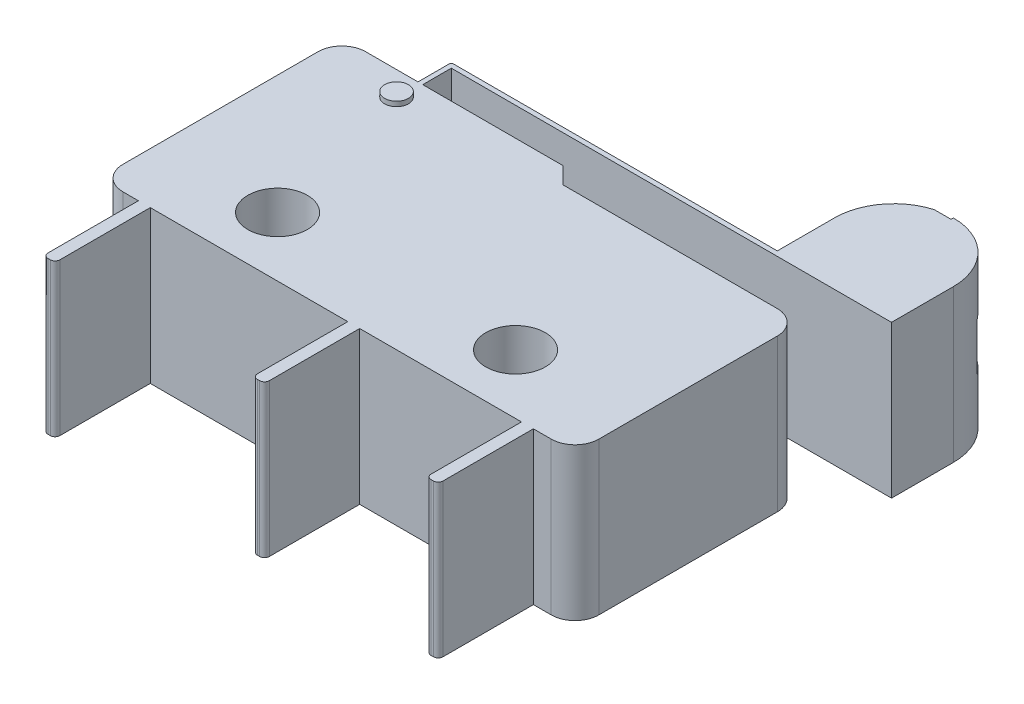
from build123d import *

# Parameters (mm, degrees)
BOSS_EXTRUDE1_DEPTH     = 6.4
FILLET1_R               = 1
SKETCH2_R               = 0.5
BOSS_EXTRUDE2_DEPTH     = 0.2
SKETCH3_W               = 18.5
SKETCH3_H               = 0.1
SKETCH3_W_2             = 0.1
SKETCH3_H_2             = 1.2
BOSS_EXTRUDE3_DEPTH     = 6.4
BOSS_EXTRUDE4_DEPTH     = 6.4
SKETCH5_R               = 1.25
CUT_EXTRUDE1_DEPTH      = 29.157059506
SKETCH6_W               = 0.5
SKETCH6_H               = 4
BOSS_EXTRUDE5_DEPTH     = 6.4
FILLET2_R               = 0.2
CUT_EXTRUDE2_DEPTH      = 10
CUT_EXTRUDE3_DEPTH      = 25.523865927
CUT_EXTRUDE3_DEPTH_BACK = 25.523865927
SKETCH9_W               = 1
SKETCH9_H               = 1


with BuildPart() as part:
    # Sketch1 → Boss-Extrude1 (new body)
    with BuildSketch(Plane(origin=(0, 0, 0), x_dir=(1, 0, 0), z_dir=(0, 1, 0))):
        Polygon((0, 0), (20, 0), (20, 9.5), (10, 9.5), (9.3, 10.2), (0, 10.2), align=None)
    extrude(amount=BOSS_EXTRUDE1_DEPTH)

    # Fillet1
    fillet1_edges = [part.edges().sort_by_distance(p)[0] for p in [
        (0, 3.2, -10.2),
        (20, 3.2, -9.5),
        (20, 3.2, 0),
        (0, 3.2, 0),
    ]]
    fillet(fillet1_edges, radius=FILLET1_R)

    # Sketch2 → Boss-Extrude2 (add)
    with BuildSketch(Plane(origin=(0, 6.4, 0), x_dir=(1, 0, 0), z_dir=(0, 1, 0))):
        with Locations(Location((3.3, 9.2, 0), (0, 0, 90))):
            Circle(SKETCH2_R)
    extrude(amount=BOSS_EXTRUDE2_DEPTH)

    # Sketch3 → Boss-Extrude3 (add)
    with BuildSketch(Plane(origin=(0, 6.4, 0), x_dir=(1, 0, 0), z_dir=(0, 1, 0))):
        with BuildLine():
            ThreePointArc((3.3, 11.6), (3.370710678, 11.570710678), (3.4, 11.5))
            Line((3.4, 11.5), (21.9, 11.5))
            Line((21.9, 11.5), (21.9, 11.6))
            Line((21.9, 11.6), (3.3, 11.6))
        make_face()
        with Locations((12.65, 11.45)):
            Rectangle(SKETCH3_W, SKETCH3_H)
        with BuildLine():
            ThreePointArc((3.4, 11.5), (3.370710678, 11.429289322), (3.3, 11.4))
            Line((3.3, 11.4), (3.4, 11.4))
            Line((3.4, 11.4), (3.4, 11.5))
        make_face()
        with BuildLine():
            ThreePointArc((3.2, 11.5), (3.229289322, 11.429289322), (3.3, 11.4))
            Line((3.3, 11.4), (3.3, 11.5))
            Line((3.3, 11.5), (3.4, 11.5))
            ThreePointArc((3.4, 11.5), (3.370710678, 11.570710678), (3.3, 11.6))
            ThreePointArc((3.3, 11.6), (3.229289322, 11.570710678), (3.2, 11.5))
        make_face()
        with BuildLine():
            Line((3.3, 11.5), (3.3, 11.4))
            ThreePointArc((3.3, 11.4), (3.370710678, 11.429289322), (3.4, 11.5))
            Line((3.4, 11.5), (3.3, 11.5))
        make_face()
        with Locations((3.35, 10.8)):
            Rectangle(SKETCH3_W_2, SKETCH3_H_2)
        with BuildLine():
            Line((3.3, 10.2), (3.3, 11.4))
            ThreePointArc((3.3, 11.4), (3.229289322, 11.429289322), (3.2, 11.5))
            Line((3.2, 11.5), (3.2, 10.2))
            Line((3.2, 10.2), (3.3, 10.2))
        make_face()
    extrude(amount=-BOSS_EXTRUDE3_DEPTH)

    # Sketch4 → Boss-Extrude4 (add)
    with BuildSketch(Plane(origin=(0, 6.4, 0), x_dir=(1, 0, 0), z_dir=(0, 1, 0))):
        with BuildLine():
            Line((20.1, 11.6), (21.9, 11.6))
            Line((21.9, 11.6), (21.9, 14))
            ThreePointArc((21.9, 14), (21.4, 12.5), (20.1, 11.6))
        make_face()
        with BuildLine():
            ThreePointArc((18.7, 11.6), (19.046446609, 11.525126266), (19.4, 11.5))
            Line((19.4, 11.5), (19.4, 11.6))
            Line((19.4, 11.6), (18.7, 11.6))
        make_face()
        with BuildLine():
            Line((19.4, 11.6), (19.4, 11.5))
            ThreePointArc((19.4, 11.5), (19.753553391, 11.525126266), (20.1, 11.6))
            Line((20.1, 11.6), (19.4, 11.6))
        make_face()
        with BuildLine():
            Line((18.7, 11.6), (19.4, 11.6))
            Line((19.4, 11.6), (19.4, 16.5))
            ThreePointArc((19.4, 16.5), (17.632233047, 15.767766953), (16.9, 14))
            ThreePointArc((16.9, 14), (17.4, 12.5), (18.7, 11.6))
        make_face()
        with BuildLine():
            Line((19.4, 16.5), (19.4, 11.6))
            Line((19.4, 11.6), (20.1, 11.6))
            ThreePointArc((20.1, 11.6), (21.4, 12.5), (21.9, 14))
            ThreePointArc((21.9, 14), (21.167766953, 15.767766953), (19.4, 16.5))
        make_face()
        with BuildLine():
            Line((16.9, 11.6), (18.7, 11.6))
            ThreePointArc((18.7, 11.6), (17.4, 12.5), (16.9, 14))
            Line((16.9, 14), (16.9, 11.6))
        make_face()
    extrude(amount=-BOSS_EXTRUDE4_DEPTH)

    # Sketch5 → Cut-Extrude1 (cut, through all)
    with BuildSketch(Plane(origin=(0, 6.4, 0), x_dir=(1, 0, 0), z_dir=(0, 1, 0))):
        with Locations(Location((15, 2.5, 0), (0, 0, 270))):
            Circle(SKETCH5_R)
        with BuildLine():
            ThreePointArc((6.25, 2.5), (5, 3.75), (3.75, 2.5))
            Line((3.75, 2.5), (6.25, 2.5))
        make_face()
        with BuildLine():
            Line((6.25, 2.5), (3.75, 2.5))
            ThreePointArc((3.75, 2.5), (5, 1.25), (6.25, 2.5))
        make_face()
    extrude(amount=-CUT_EXTRUDE1_DEPTH, mode=Mode.SUBTRACT)

    # Sketch6 → Boss-Extrude5 (add)
    with BuildSketch(Plane(origin=(0, 6.4, 0), x_dir=(1, 0, 0), z_dir=(0, 1, 0))):
        with Locations((1.9, -2)):
            Rectangle(SKETCH6_W, SKETCH6_H)
        with Locations((10.7, -2)):
            Rectangle(SKETCH6_W, SKETCH6_H)
        with Locations((18, -2)):
            Rectangle(SKETCH6_W, SKETCH6_H)
    extrude(amount=-BOSS_EXTRUDE5_DEPTH)

    # Fillet2
    fillet2_edges = [part.edges().sort_by_distance(p)[0] for p in [
        (2.15, 3.2, 4),
        (1.65, 3.2, 4),
        (10.45, 3.2, 4),
        (10.95, 3.2, 4),
        (17.75, 3.2, 4),
        (18.25, 3.2, 4),
    ]]
    fillet(fillet2_edges, radius=FILLET2_R)

    # Sketch7 → Cut-Extrude2 (cut)
    with BuildSketch(Plane(origin=(0, 6.4, 0), x_dir=(1, 0, 0), z_dir=(0, 1, 0))):
        with BuildLine():
            ThreePointArc((18.7, 16.4), (19.046446609, 16.474873734), (19.4, 16.5))
            ThreePointArc((19.4, 16.5), (19.753553391, 16.474873734), (20.1, 16.4))
            Line((20.1, 16.4), (20.417508918, 16.4))
            Line((20.417508918, 16.4), (20.417508918, 16.594496766))
            Line((20.417508918, 16.594496766), (18.102606367, 16.594496766))
            Line((18.102606367, 16.594496766), (18.102606367, 16.4))
            Line((18.102606367, 16.4), (18.7, 16.4))
        make_face()
        with BuildLine():
            Line((19.4, 16.4), (19.4, 16.5))
            ThreePointArc((19.4, 16.5), (19.046446609, 16.474873734), (18.7, 16.4))
            Line((18.7, 16.4), (19.4, 16.4))
        make_face()
    extrude(amount=-CUT_EXTRUDE2_DEPTH, mode=Mode.SUBTRACT)

    # Sketch9 → Cut-Extrude3 (cut, two sides: drawn at the far end of the back side and taken through both)
    with BuildSketch(Plane.ZY.offset(-16.9).offset(-CUT_EXTRUDE3_DEPTH_BACK)):
        with Locations((-16, 3.7)):
            Rectangle(SKETCH9_W, SKETCH9_H)
        with Locations((-16, 2.7)):
            Rectangle(SKETCH9_W, SKETCH9_H)
    extrude(amount=CUT_EXTRUDE3_DEPTH + CUT_EXTRUDE3_DEPTH_BACK, mode=Mode.SUBTRACT)


solid = part.part
